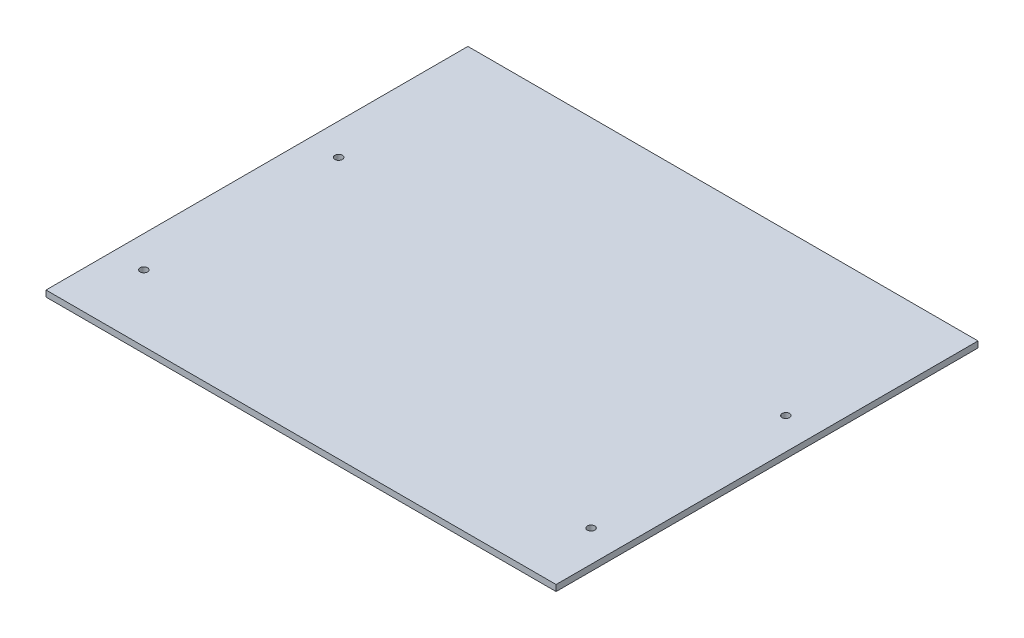
from build123d import *

# Parameters (mm, degrees)
SKETCH1_W           = 463.55
SKETCH1_H           = 383.413
SKETCH1_R           = 3.3782
BOSS_EXTRUDE1_DEPTH = 5.588


with BuildPart() as part:
    # Sketch1 → Boss-Extrude1 (new body)
    with BuildSketch(Plane(origin=(0, 0, 0), x_dir=(1, 0, 0), z_dir=(0, 1, 0))):
        with Locations((231.775, 191.7065)):
            Rectangle(SKETCH1_W, SKETCH1_H)
        with Locations(Location((28.575, 60.325, 0), (0, 0, 270))):
            Circle(SKETCH1_R, mode=Mode.SUBTRACT)
        with Locations(Location((28.575, 237.363, 0), (0, 0, 270))):
            Circle(SKETCH1_R, mode=Mode.SUBTRACT)
        with Locations(Location((434.975, 237.363, 0), (0, 0, 90))):
            Circle(SKETCH1_R, mode=Mode.SUBTRACT)
        with Locations(Location((434.975, 60.325, 0), (0, 0, 90))):
            Circle(SKETCH1_R, mode=Mode.SUBTRACT)
    extrude(amount=BOSS_EXTRUDE1_DEPTH)


solid = part.part
